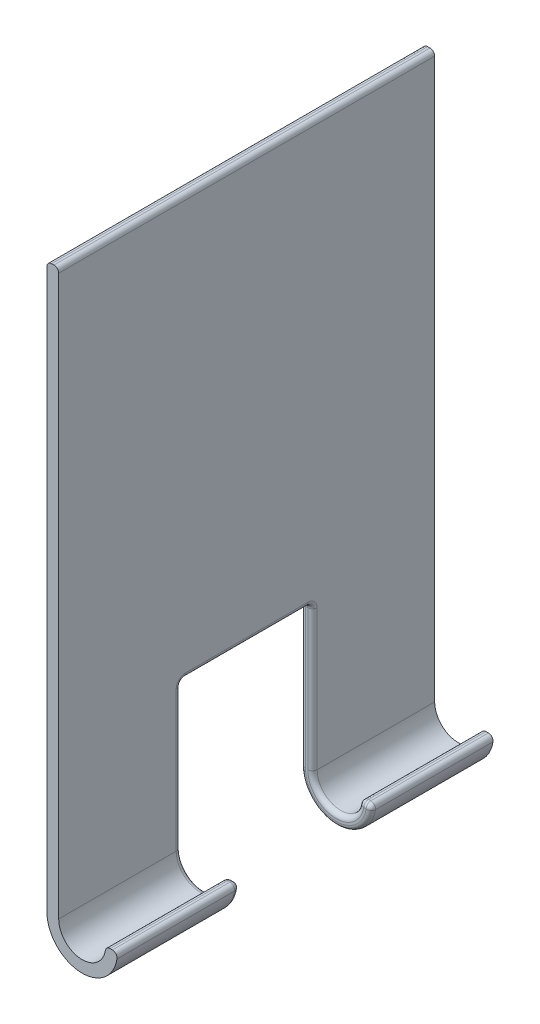
from build123d import *

# Parameters (mm, degrees)
EXTRUDE_1_DEPTH     = 80
SKETCH_2_W          = 28
SKETCH_2_H          = 76.722275626
CUT_EXTRUDE_2_DEPTH = 40
FILLET_1_R          = 1
FILLET_2_R          = 1
FILLET_3_R          = 1
SKETCH_4_W          = 17.86
SKETCH_4_H          = 9
EXTRUDE_2_DEPTH     = 10
EXTRUDE_3_DEPTH     = 17.89
SKETCH_6_R          = 2
CUT_EXTRUDE_3_DEPTH = 131.448569854


with BuildPart() as part:
    # 草图1 → 凸台-拉伸1 (new body)
    with BuildSketch(Plane.XY):
        with BuildLine():
            Line((0, 0), (0, 120))
            Line((0, 120), (2.5, 120))
            Line((2.5, 120), (2.5, 0))
            ThreePointArc((2.5, 0), (7.5, -5), (12.5, 0))
            Line((12.5, 0), (15, 0))
            ThreePointArc((15, 0), (7.5, -7.5), (0, 0))
        make_face()
    extrude(amount=EXTRUDE_1_DEPTH)

    # 草图2 → 切除-拉伸2 (cut, symmetric)
    with BuildSketch(Plane(origin=(2.5, 0, 0), x_dir=(0, 0, -1), z_dir=(1, 0, 0))):
        with Locations((-40, -7.5)):
            Rectangle(SKETCH_2_W, SKETCH_2_H)
    extrude(amount=CUT_EXTRUDE_2_DEPTH, both=True, mode=Mode.SUBTRACT)

    # 圆角1
    fillet_1_edges = [part.edges().sort_by_distance(p)[0] for p in [
        (12.5, 0, 67),
        (15, 0, 67),
        (12.5, 0, 13),
        (15, 0, 13),
    ]]
    fillet(fillet_1_edges, radius=FILLET_1_R)

    # 圆角2
    fillet_2_edges = [part.edges().sort_by_distance(p)[0] for p in [
        (0, 120, 40),
        (2.5, 120, 40),
    ]]
    fillet(fillet_2_edges, radius=FILLET_2_R)

    # 圆角3
    fillet_3_edges = [part.edges().sort_by_distance(p)[0] for p in [
        (0, 30.861137813, 40),
        (0, 15.430568906, 54),
        (0, 15.430568906, 26),
        (1.25, 30.861137813, 26),
        (2.5, 15.430568906, 26),
        (7.081868699, -4.982485947, 26),
        (2.5, 15.430568906, 54),
        (6.921352125, -7.477644458, 54),
        (1.25, 30.861137813, 54),
        (2.5, 30.861137813, 40),
        (13.669348036, 0, 26),
        (6.921352125, -7.477644458, 26),
        (14.682170815, -0.349556364, 26),
        (12.770582559, -0.236237384, 26),
        (7.081868699, -4.982485947, 54),
        (13.669348036, 0, 54),
        (14.682170815, -0.349556364, 54),
        (12.770582559, -0.236237384, 54),
    ]]
    fillet(fillet_3_edges, radius=FILLET_3_R)

    # 草图4 → 凸台-拉伸2 (add)
    with BuildSketch(Plane.ZY):
        with Locations((40, 64.861137813)):
            Rectangle(SKETCH_4_W, SKETCH_4_H)
    extrude(amount=EXTRUDE_2_DEPTH)

    # 草图5 → 凸台-拉伸3 (add)
    with BuildSketch(Plane.XY.offset(48.93)):
        with BuildLine():
            Line((-10, 69.361137813), (-10, 60.361137813))
            ThreePointArc((-10, 60.361137813), (-14.5, 64.861137813), (-10, 69.361137813))
        make_face()
    extrude(amount=-EXTRUDE_3_DEPTH)

    # 草图6 → 切除-拉伸3 (cut, through all)
    with BuildSketch(Plane.XY.offset(48.93)):
        with Locations((-10, 64.861137813)):
            Circle(SKETCH_6_R)
    extrude(amount=-CUT_EXTRUDE_3_DEPTH, mode=Mode.SUBTRACT)


solid = part.part
